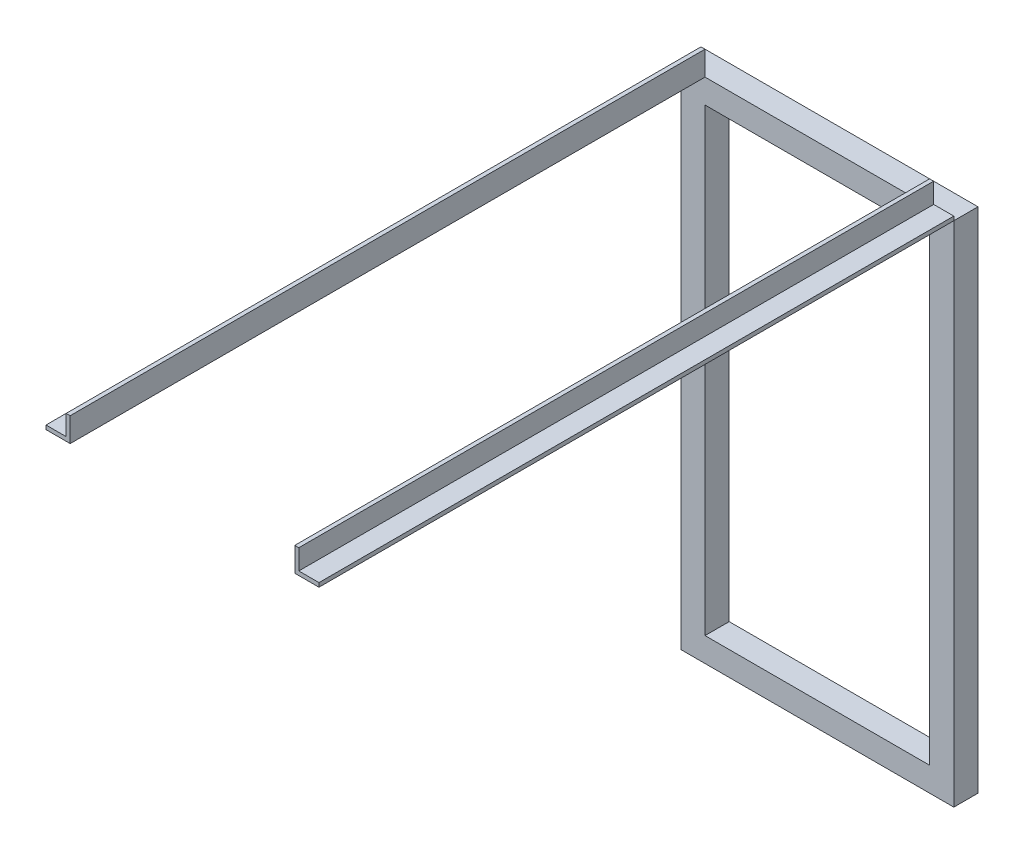
from build123d import *

# Parameters (mm, degrees)
CROQUIS1_W                = 430
CROQUIS1_H                = 800
CROQUIS1_W_2              = 353.8
CROQUIS1_H_2              = 723.8
SALIENTE_EXTRUIR1_DEPTH   = 38.1
SALIENTE_EXTRUIR2_DEPTH   = 1000
SALIENTE_EXTRUIR2_2_DEPTH = 1000


with BuildPart() as part:
    # Croquis1 → Saliente-Extruir1 (new body)
    with BuildSketch(Plane.XY):
        with Locations((215, 400)):
            Rectangle(CROQUIS1_W, CROQUIS1_H)
        with Locations((215, 400)):
            Rectangle(CROQUIS1_W_2, CROQUIS1_H_2, mode=Mode.SUBTRACT)
    extrude(amount=SALIENTE_EXTRUIR1_DEPTH)


with BuildPart() as body_2:
    # Croquis3 → Saliente-Extruir2 (new body)
    with BuildSketch(Plane.XY.offset(38.1)):
        Polygon((0, 800), (38.1, 800), (38.1, 838.1), (31.75, 838.1), (31.75, 806.35), (0, 806.35), align=None)
    extrude(amount=SALIENTE_EXTRUIR2_DEPTH)


with BuildPart() as body_3:
    # Croquis3 → Saliente-Extruir2 2 (new body)
    with BuildSketch(Plane.XY.offset(38.1)):
        Polygon((398.25, 838.1), (391.9, 838.1), (391.9, 800), (430, 800), (430, 806.35), (398.25, 806.35), align=None)
    extrude(amount=SALIENTE_EXTRUIR2_2_DEPTH)


solid = Compound([part.part, body_2.part, body_3.part])
